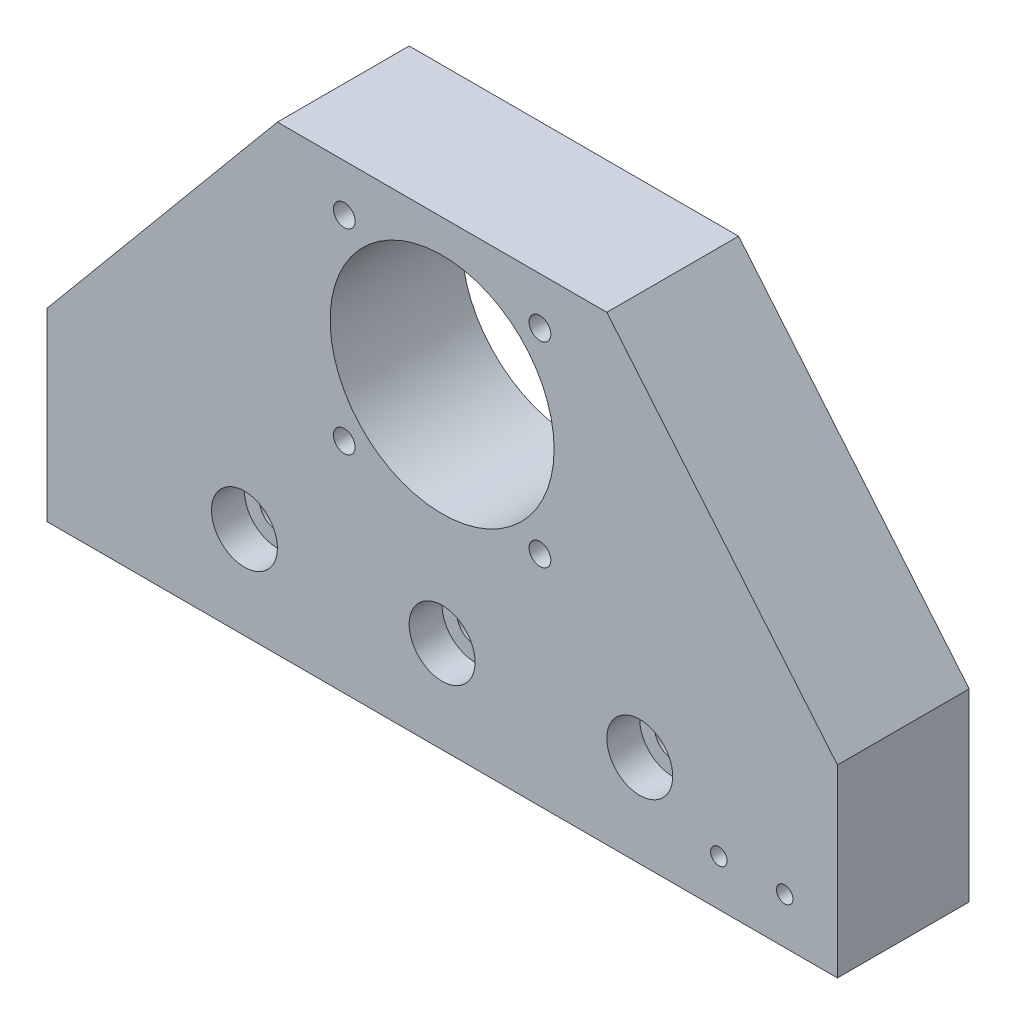
from build123d import *

# Parameters (mm, degrees)
BOSS_EXTRUDE1_DEPTH            = 20
CBORE_FOR_M5_SHCS1_D           = 5.5
CBORE_FOR_M5_SHCS1_CBORE_D     = 10
CBORE_FOR_M5_SHCS1_CBORE_DEPTH = 5
SKETCH4_R                      = 17
CUT_EXTRUDE1_DEPTH             = 95.339811321
M4_TAPPED_HOLE1_D              = 3.3
M4_TAPPED_HOLE2_D              = 3.3
M4_TAPPED_HOLE2_DEPTH          = 15
M4_TAPPED_HOLE2_TIP            = 0.991420021
M3_TAPPED_HOLE1_D              = 2.5
M3_TAPPED_HOLE1_DEPTH          = 7.5
M3_TAPPED_HOLE1_TIP            = 0.751075774


with BuildPart() as part:
    # Sketch1 → Boss-Extrude1 (new body)
    with BuildSketch(Plane.XY):
        Polygon((60, 0), (-60, 0), (-60, 28), (-25, 70), (25, 70), (60, 28), align=None)
    extrude(amount=BOSS_EXTRUDE1_DEPTH)

    # CBORE for M5 SHCS1 (through all)
    with Locations(Plane(origin=(-30, 14, 20), x_dir=(1, 0, 0), z_dir=(0, 0, 1))):
        with Locations((0, 0), (30, 0), (60, 0)):
            CounterBoreHole(CBORE_FOR_M5_SHCS1_D / 2, CBORE_FOR_M5_SHCS1_CBORE_D / 2, CBORE_FOR_M5_SHCS1_CBORE_DEPTH)

    # Sketch4 → Cut-Extrude1 (cut, through all)
    with BuildSketch(Plane.XY.offset(20)):
        with Locations((0, 48)):
            Circle(SKETCH4_R)
    extrude(amount=-CUT_EXTRUDE1_DEPTH, mode=Mode.SUBTRACT)

    # M4 Tapped Hole1 (through all)
    with Locations(Plane(origin=(-14.849242405, 62.849242405, 20), x_dir=(1, 0, 0), z_dir=(0, 0, 1))):
        with Locations((0, 0), (29.69848481, 0), (29.69848481, -29.69848481), (0, -29.69848481)):
            Hole(M4_TAPPED_HOLE1_D / 2)

    # M4 Tapped Hole2
    with Locations(Plane(origin=(0, 0, 0), x_dir=(-1, 0, 0), z_dir=(0, -1, 0))):
        with Locations((20, -10), (-20, -10)):
            Hole(M4_TAPPED_HOLE2_D / 2, depth=M4_TAPPED_HOLE2_DEPTH)
            with Locations((0, 0, -(M4_TAPPED_HOLE2_DEPTH + M4_TAPPED_HOLE2_TIP / 2))):  # 118° drill point
                Cone(0, M4_TAPPED_HOLE2_D / 2, M4_TAPPED_HOLE2_TIP, mode=Mode.SUBTRACT)

    # M3 Tapped Hole1
    with Locations(Plane(origin=(42, 7, 20), x_dir=(1, 0, 0), z_dir=(0, 0, 1))):
        with Locations((0, 0), (10, 0)):
            Hole(M3_TAPPED_HOLE1_D / 2, depth=M3_TAPPED_HOLE1_DEPTH)
            with Locations((0, 0, -(M3_TAPPED_HOLE1_DEPTH + M3_TAPPED_HOLE1_TIP / 2))):  # 118° drill point
                Cone(0, M3_TAPPED_HOLE1_D / 2, M3_TAPPED_HOLE1_TIP, mode=Mode.SUBTRACT)


solid = part.part
